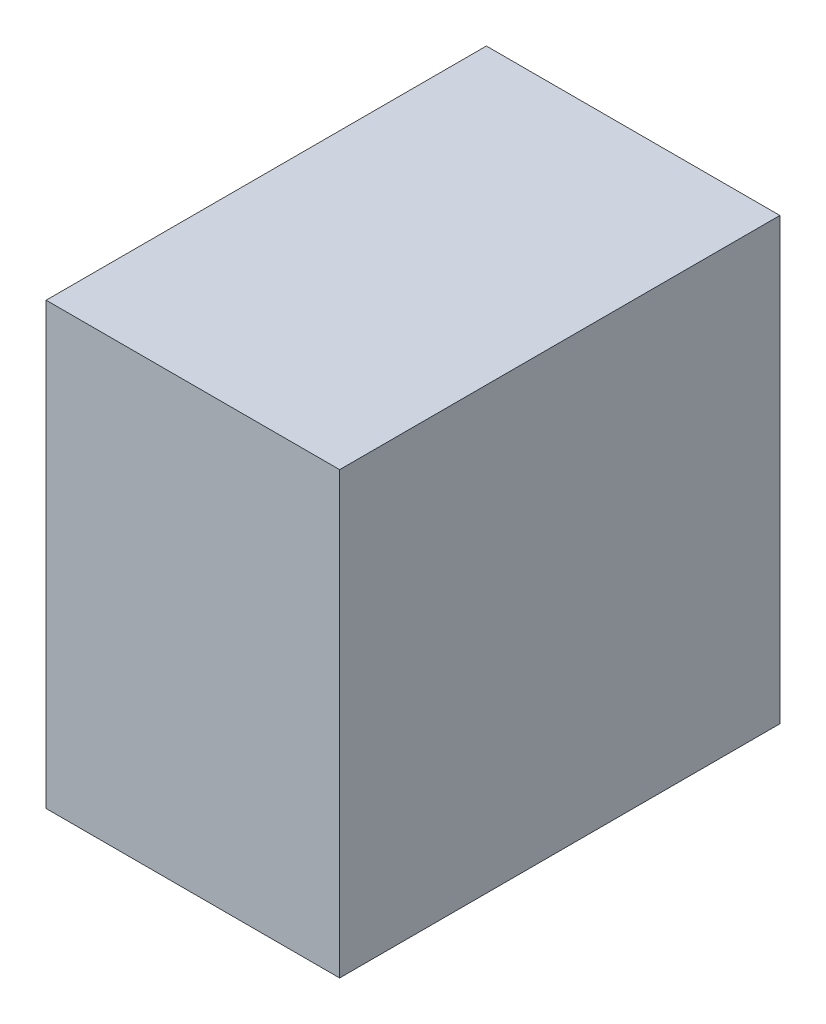
from build123d import *

# Parameters (mm, degrees)
SKETCH1_W           = 40
SKETCH1_H           = 60
BOSS_EXTRUDE1_DEPTH = 60


with BuildPart() as part:
    # Sketch1 → Boss-Extrude1 (new body)
    with BuildSketch(Plane(origin=(0, 0, 0), x_dir=(1, 0, 0), z_dir=(0, 1, 0))):
        Rectangle(SKETCH1_W, SKETCH1_H)
    extrude(amount=BOSS_EXTRUDE1_DEPTH)


solid = part.part
